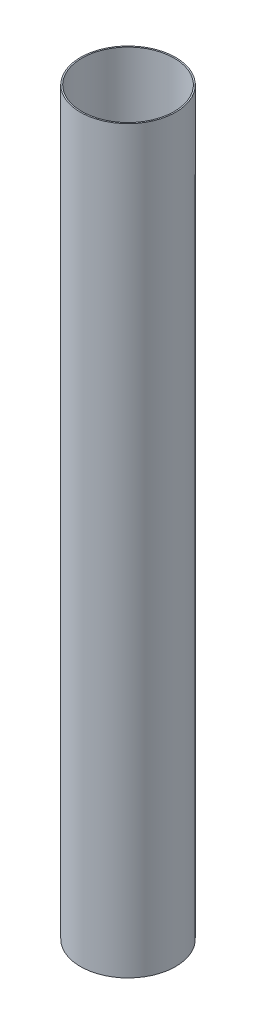
from build123d import *

# Parameters (mm, degrees)
SKETCH1_R           = 78.4225
SKETCH1_R_2         = 76.2
BOSS_EXTRUDE1_DEPTH = 1219.2


with BuildPart() as part:
    # Sketch1 → Boss-Extrude1 (new body)
    with BuildSketch(Plane(origin=(0, 0, 0), x_dir=(1, 0, 0), z_dir=(0, 1, 0))):
        with Locations(Location((0, 0, 0), (0, 0, 90))):
            Circle(SKETCH1_R)
        with Locations(Location((0, 0, 0), (0, 0, 90))):
            Circle(SKETCH1_R_2, mode=Mode.SUBTRACT)
    extrude(amount=BOSS_EXTRUDE1_DEPTH)


solid = part.part
